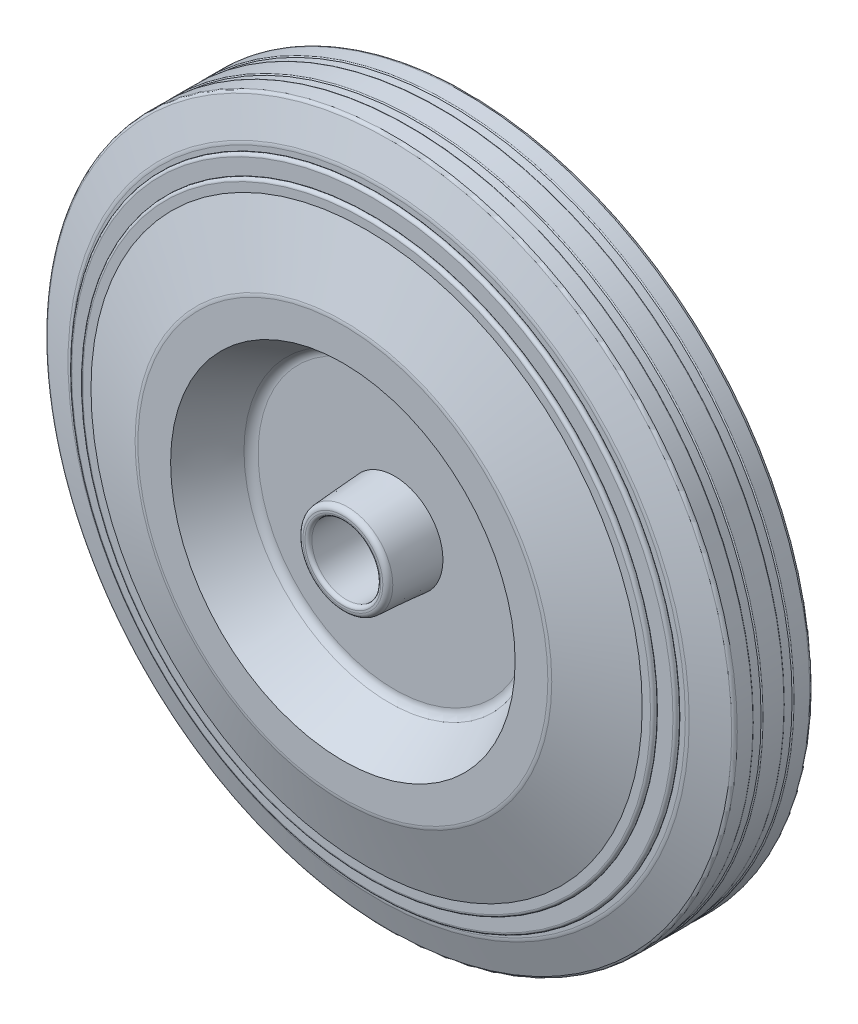
from build123d import *

# Parameters (mm, degrees)
FILLET1_R     = 1
SCALE_1_SCALE = 0.5


with BuildPart() as part:
    # Schizzo1 → Rivoluzione1 (revolve)
    with BuildSketch(Plane(origin=(0, 0, 0), x_dir=(1, 0, 0), z_dir=(0, 1, 0))):
        with BuildLine():
            Line((87.2605271941896, 16.44678106754003), (82.4201757313965, 16.44678106754))
            ThreePointArc((82.4201757313965, 16.44678106754), (83.2535090647299, 17.2801144008734), (82.4201757313965, 18.11344773420673))
            Line((82.4201757313965, 18.11344773420673), (79.99999999999999, 18.11344773420663))
            Line((79.99999999999999, 18.11344773420663), (60.474676636127214, 24.83655572679794))
            ThreePointArc((60.474676636127214, 24.83655572679794), (59.99311499033776, 24.95885680461168), (59.4979721727557, 24.99999999999998))
            Line((59.4979721727557, 24.99999999999998), (49.99999999999997, 25.000000000000004))
            Line((49.99999999999997, 25.000000000000004), (42.20577136594006, 11.500000000000028))
            ThreePointArc((42.20577136594006, 11.500000000000028), (41.10769515458673, 10.401923788646677), (39.6076951545867, 9.999999999999979))
            Line((39.6076951545867, 9.999999999999979), (14.048902179152646, 10.000000000000009))
            Line((14.048902179152646, 10.000000000000009), (13.097573446183237, 23.604634710616196))
            ThreePointArc((13.097573446183237, 23.604634710616196), (12.624224910887241, 24.597030552428766), (11.601227370793486, 25.000000000000007))
            Line((11.601227370793486, 25.000000000000007), (10.000000000000002, 25.00000000000002))
            Line((10.000000000000002, 25.00000000000002), (9.999999999999998, -25))
            Line((9.999999999999998, -25), (11.601227370793488, -25))
            ThreePointArc((11.601227370793488, -25), (12.624224910887236, -24.597030552428755), (13.097573446183231, -23.60463471061619))
            Line((13.097573446183231, -23.60463471061619), (14.048902179152646, -10.000000000000009))
            Line((14.048902179152646, -10.000000000000009), (39.6076951545867, -10))
            ThreePointArc((39.6076951545867, -10), (41.10769515458673, -10.40192378864666), (42.205771365940045, -11.5))
            Line((42.205771365940045, -11.5), (49.999999999999986, -25.000000000000007))
            Line((49.999999999999986, -25.000000000000007), (59.4979721727557, -25))
            ThreePointArc((59.4979721727557, -25), (59.99311499033773, -24.958856804611713), (60.47467663612716, -24.83655572679798))
            Line((60.47467663612716, -24.83655572679798), (80, -18.11344773420663))
            Line((80, -18.11344773420663), (82.42017573139651, -18.1134477342067))
            ThreePointArc((82.42017573139651, -18.1134477342067), (83.2535090647298, -17.280114400873398), (82.4201757313965, -16.446781067540073))
            Line((82.4201757313965, -16.446781067540073), (87.2605271941896, -16.44678106754))
            ThreePointArc((87.2605271941896, -16.44678106754), (88.0938605275229, -15.613447734206705), (87.2605271941896, -14.780114400873373))
            Line((87.2605271941896, -14.780114400873373), (89.17867509834181, -14.7801144008734))
            ThreePointArc((89.17867509834181, -14.7801144008734), (89.67381791592385, -14.738971205485093), (90.1553795617133, -14.616670127671355))
            Line((90.1553795617133, -14.616670127671355), (99.32556815445719, -11.459120976115656))
            ThreePointArc((99.32556815445719, -11.459120976115656), (99.81411551835629, -11.094305356227293), (100.00000000000001, -10.513602400516405))
            Line((100.00000000000001, -10.513602400516405), (100, -6))
            ThreePointArc((100, -6), (99.91213203435596, -5.787867965644052), (99.70000000000002, -5.700000000000005))
            Line((99.70000000000002, -5.700000000000005), (99.70000000000002, -3.3))
            ThreePointArc((99.70000000000002, -3.3), (99.91213203435598, -3.212132034355966), (100, -3.000000000000006))
            Line((100, -3.000000000000006), (100, 2.999999999999994))
            ThreePointArc((100, 2.999999999999994), (99.91213203435596, 3.212132034355946), (99.70000000000002, 3.299999999999995))
            Line((99.70000000000002, 3.299999999999995), (99.70000000000002, 5.7))
            ThreePointArc((99.70000000000002, 5.7), (99.91213203435598, 5.787867965644034), (100, 5.999999999999994))
            Line((100, 5.999999999999994), (100, 10.513602400516397))
            ThreePointArc((100, 10.513602400516397), (99.81411551835633, 11.094305356227311), (99.32556815445722, 11.459120976115704))
            Line((99.32556815445722, 11.459120976115704), (90.15537956171327, 14.616670127671313))
            ThreePointArc((90.15537956171327, 14.616670127671313), (89.67381791592383, 14.73897120548505), (89.1786750983418, 14.780114400873405))
            Line((89.1786750983418, 14.780114400873405), (87.2605271941896, 14.78011440087336))
            ThreePointArc((87.2605271941896, 14.78011440087336), (88.09386052752293, 15.613447734206694), (87.2605271941896, 16.44678106754003))
        make_face()
    revolve(axis=Axis((5.7e-16, 0, -25.003871846073736), (-6e-17, 0, 1)))

    # Fillet1
    fillet1_edges = [part.edges().sort_by_distance(p)[0] for p in [
        (-10.000000000000002, 1.22e-15, 25),
        (-10.000000000000002, 1.22e-15, -25.00000000000002),
        (-49.99999999999997, -1.608e-14, -25.00000000000001),
        (-79.99999999999999, 9.8e-15, -18.11344773420664),
        (-82.4201757313965, 4.67e-14, -16.446781067540012),
    ]]
    fillet(fillet1_edges, radius=FILLET1_R)


with BuildPart() as part_1:
    # 缩放比例1: scaled about (0, 0, 0)
    add(part.part.scale(SCALE_1_SCALE))


solid = part_1.part
